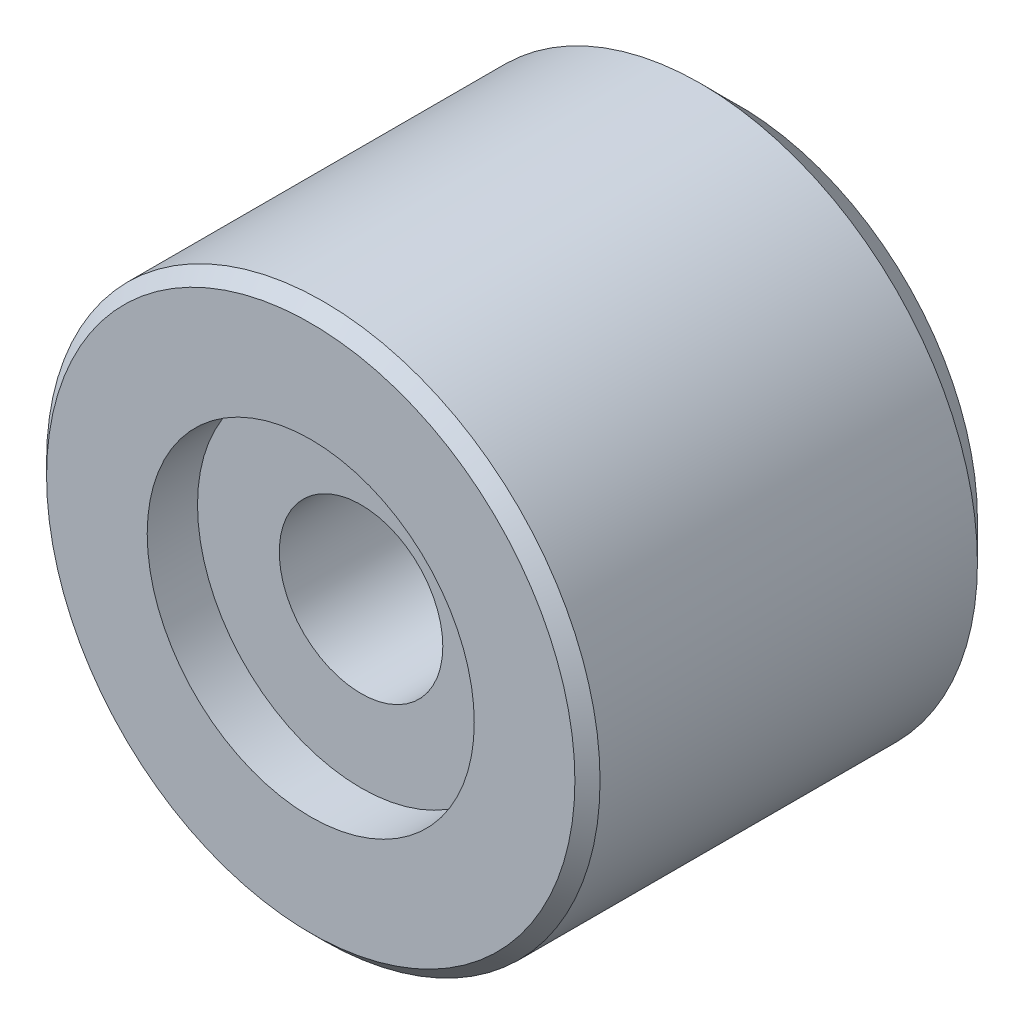
from build123d import *

# Parameters (mm, degrees)
SKETCH1_R           = 11
BOSS_EXTRUDE1_DEPTH = 17
CUT_EXTRUDE1_DEPTH  = 12.5
SKETCH3_R           = 6.5
CUT_EXTRUDE2_DEPTH  = 2
SKETCH4_R           = 3.25
CUT_EXTRUDE3_DEPTH  = 4.5
CHAMFER1_SIZE       = 1.5
CHAMFER2_SIZE       = 0.5


with BuildPart() as part:
    # Sketch1 → Boss-Extrude1 (new body)
    with BuildSketch(Plane.XY):
        Circle(SKETCH1_R)
    extrude(amount=BOSS_EXTRUDE1_DEPTH)

    # Sketch2 → Cut-Extrude1 (cut)
    with BuildSketch(Plane.XY.offset(17)):
        with BuildLine():
            Line((1.6, 2.828869032), (1.6, -2.828869032))
            ThreePointArc((1.6, -2.828869032), (-3.25, 0), (1.6, 2.828869032))
        make_face()
    extrude(amount=-CUT_EXTRUDE1_DEPTH, mode=Mode.SUBTRACT)

    # Sketch3 → Cut-Extrude2 (cut)
    with BuildSketch(Plane.XY.offset(17)):
        Circle(SKETCH3_R)
    extrude(amount=-CUT_EXTRUDE2_DEPTH, mode=Mode.SUBTRACT)

    # Sketch4 → Cut-Extrude3 (cut)
    with BuildSketch(Plane.XY.offset(17)):
        Circle(SKETCH4_R)
    extrude(amount=-CUT_EXTRUDE3_DEPTH, mode=Mode.SUBTRACT)

    # Chamfer1
    chamfer1_edges = [part.edges().sort_by_distance(p)[0] for p in [
        (-11, 0, 0),
    ]]
    chamfer(chamfer1_edges, length=CHAMFER1_SIZE)

    # Chamfer2
    chamfer2_edges = [part.edges().sort_by_distance(p)[0] for p in [
        (-11, 0, 17),
    ]]
    chamfer(chamfer2_edges, length=CHAMFER2_SIZE)


solid = part.part
